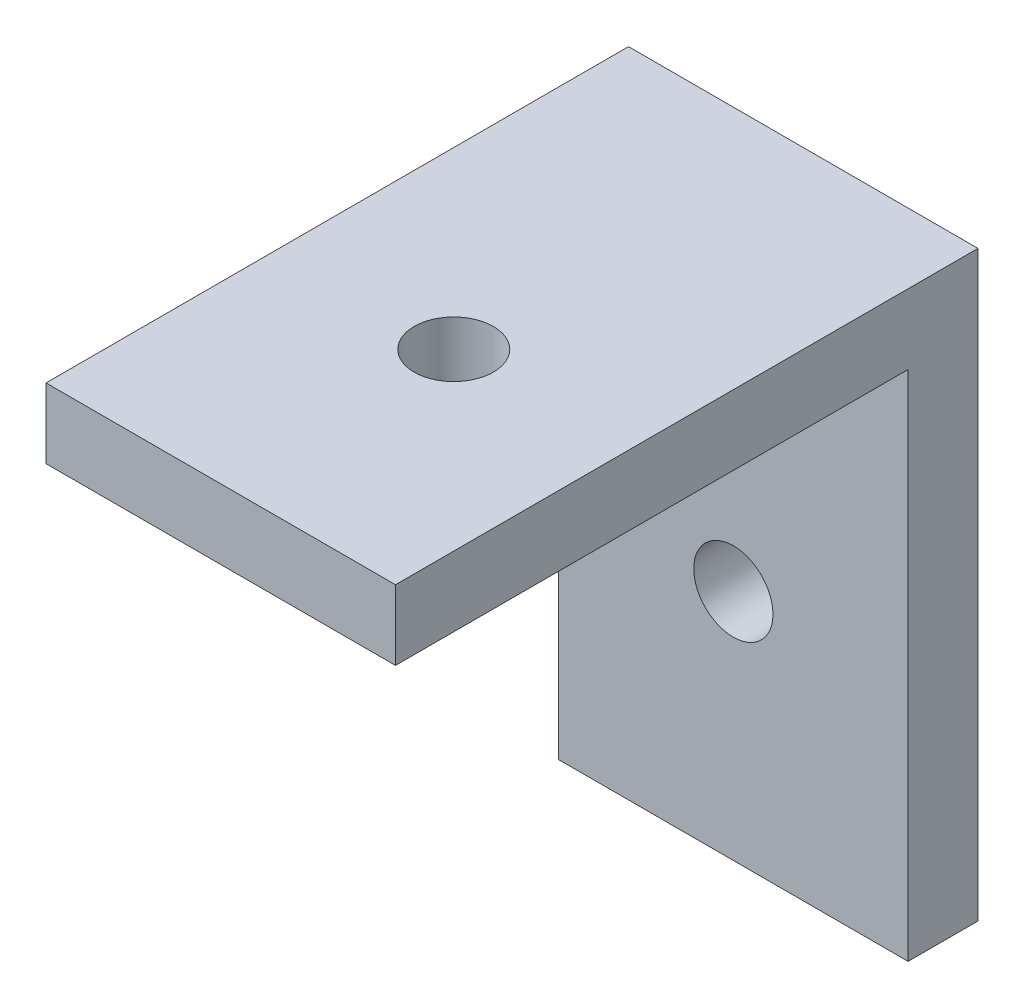
from build123d import *

# Parameters (mm, degrees)
CROQUIS1_W           = 15
CROQUIS1_H           = 25
ALA_HORIZONTAL_DEPTH = 3
ALA_VERTICAL_START   = -3
CROQUIS2_W           = 15
CROQUIS2_H           = 25
ALA_VERTICAL_DEPTH   = 3
CROQUIS3_R           = 1.7
BARRENO_M3_H_DEPTH   = 3
BARRENO_M3_V_START   = -3
CROQUIS4_R           = 1.7
BARRENO_M3_V_DEPTH   = 3


with BuildPart() as part:
    # Croquis1 → Ala_horizontal (new body)
    with BuildSketch(Plane.XY):
        with Locations((0, -12.5)):
            Rectangle(CROQUIS1_W, CROQUIS1_H)
    extrude(amount=ALA_HORIZONTAL_DEPTH)

    # Croquis2 → Ala_vertical (add)
    with BuildSketch(Plane(origin=(0, 0, 0), x_dir=(1, 0, 0), z_dir=(0, 1, 0)).offset(ALA_VERTICAL_START)):
        with Locations((0, -12.5)):
            Rectangle(CROQUIS2_W, CROQUIS2_H)
    extrude(amount=ALA_VERTICAL_DEPTH)

    # Croquis3 → Barreno_M3_h (cut)
    with BuildSketch(Plane.XY):
        with Locations((0, -15)):
            Circle(CROQUIS3_R)
    extrude(amount=BARRENO_M3_H_DEPTH, mode=Mode.SUBTRACT)

    # Croquis4 → Barreno_M3_v (cut)
    with BuildSketch(Plane(origin=(0, 0, 0), x_dir=(1, 0, 0), z_dir=(0, 1, 0)).offset(BARRENO_M3_V_START)):
        with Locations(Location((0, -15, 0), (0, 0, 270))):
            Circle(CROQUIS4_R)
    extrude(amount=BARRENO_M3_V_DEPTH, mode=Mode.SUBTRACT)


solid = part.part
